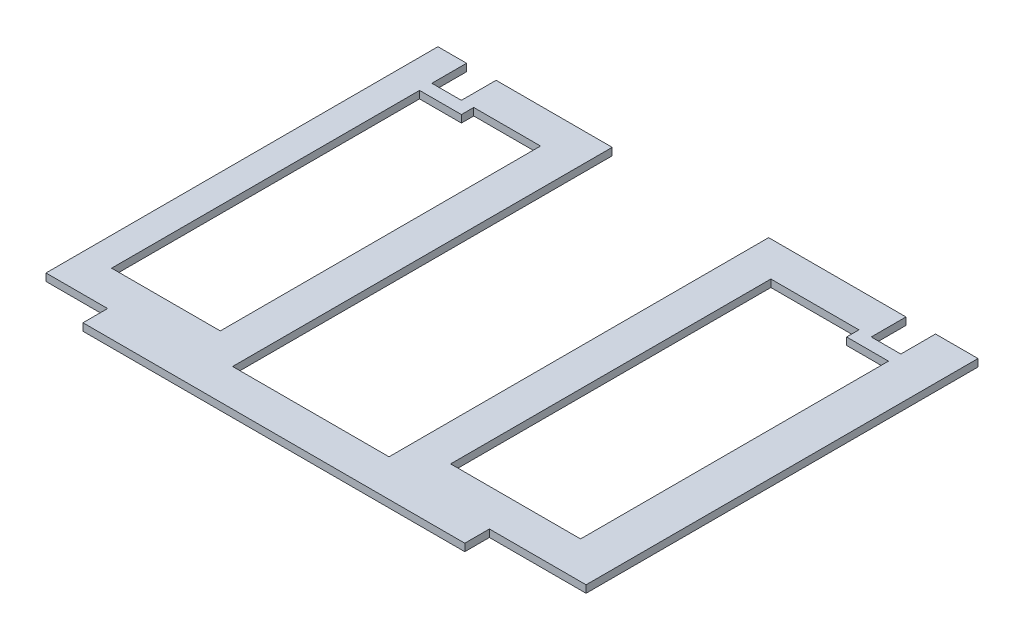
from build123d import *

# Parameters (mm, degrees)
SKETCH1_W           = 225.24
SKETCH1_H           = 169.09
BOSS_EXTRUDE1_DEPTH = 3
SKETCH2_W           = 63.5
SKETCH2_H           = 154.09
SKETCH2_W_2         = 45.24
SKETCH2_H_2         = 10
SKETCH2_W_3         = 25.01
CUT_EXTRUDE1_DEPTH  = 204.183888387
SKETCH3_W           = 5
SKETCH3_H           = 3
BOSS_EXTRUDE2_DEPTH = 17
SKETCH4_W           = 5
SKETCH4_H           = 3
BOSS_EXTRUDE3_DEPTH = 17
SKETCH5_W           = 6
SKETCH5_H           = 159.09
CUT_EXTRUDE2_DEPTH  = 204.183888387


with BuildPart() as part:
    # Sketch1 → Boss-Extrude1 (new body)
    with BuildSketch(Plane(origin=(0, 0, 0), x_dir=(1, 0, 0), z_dir=(0, 1, 0))):
        with Locations((0, 84.545)):
            Rectangle(SKETCH1_W, SKETCH1_H)
    extrude(amount=BOSS_EXTRUDE1_DEPTH)

    # Sketch2 → Cut-Extrude1 (cut, through all)
    with BuildSketch(Plane(origin=(0, 0, 0), x_dir=(1, 0, 0), z_dir=(0, 1, 0))):
        Polygon((36.63, 25), (36.63, 155), (77.38, 155), (77.38, 169.09), (89.38, 169.09), (89.38, 25), align=None)
        Polygon((-100.99, 169.09), (-89, 169.09), (-89, 155), (-56.87, 155), (-56.87, 25), (-100.99, 25), align=None)
        with Locations((-10.12, 92.045)):
            Rectangle(SKETCH2_W, SKETCH2_H)
        with Locations((90, 5)):
            Rectangle(SKETCH2_W_2, SKETCH2_H_2)
        with Locations((-100.115, 5)):
            Rectangle(SKETCH2_W_3, SKETCH2_H_2)
    extrude(amount=CUT_EXTRUDE1_DEPTH, mode=Mode.SUBTRACT)

    # Sketch3 → Boss-Extrude2 (add)
    with BuildSketch(Plane.ZY.offset(-89.38)):
        with Locations((-152.5, 1.5)):
            Rectangle(SKETCH3_W, SKETCH3_H)
    extrude(amount=BOSS_EXTRUDE2_DEPTH)

    # Sketch4 → Boss-Extrude3 (add)
    with BuildSketch(Plane(origin=(-100.99, 0, 0), x_dir=(0, 0, -1), z_dir=(1, 0, 0))):
        with Locations((152.5, 1.5)):
            Rectangle(SKETCH4_W, SKETCH4_H)
    extrude(amount=BOSS_EXTRUDE3_DEPTH)

    # Sketch5 → Cut-Extrude2 (cut, through all)
    with BuildSketch(Plane(origin=(0, 3, 0), x_dir=(1, 0, 0), z_dir=(0, 1, 0))):
        with Locations((109.62, 89.545)):
            Rectangle(SKETCH5_W, SKETCH5_H)
    extrude(amount=-CUT_EXTRUDE2_DEPTH, mode=Mode.SUBTRACT)


solid = part.part
